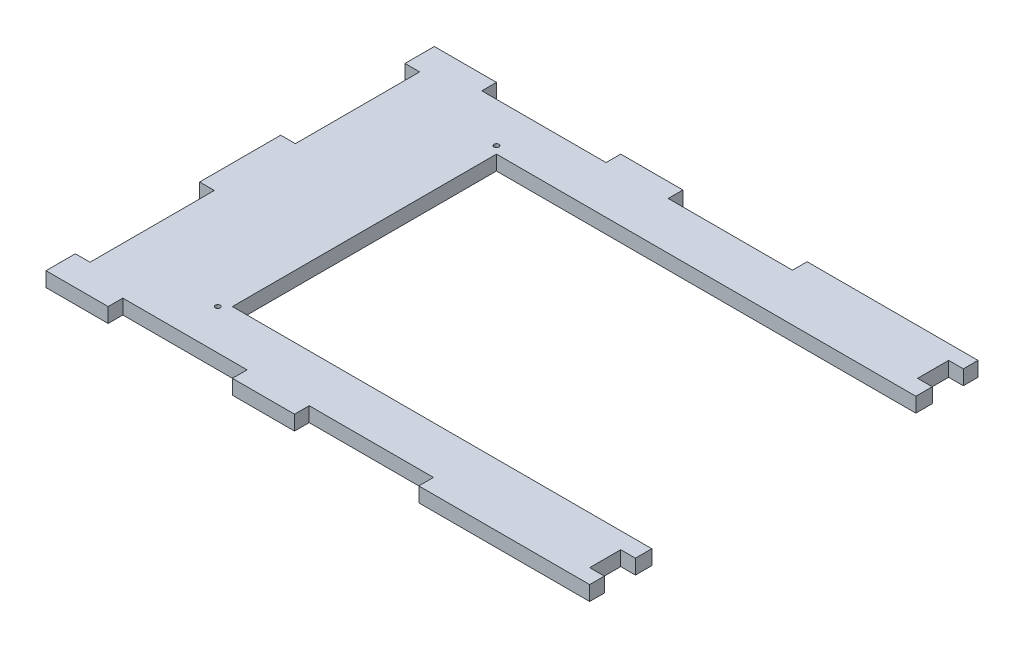
from build123d import *

# Parameters (mm, degrees)
SKETCH1_R           = 0.5
BOSS_EXTRUDE1_DEPTH = 3


with BuildPart() as part:
    # Sketch1 → Boss-Extrude1 (new body)
    with BuildSketch(Plane(origin=(0, 0, 0), x_dir=(1, 0, 0), z_dir=(0, 1, 0))):
        Polygon((42.8625, 26.9875), (42.8625, 30.3375), (39.8625, 30.3375), (39.8625, 36.6875), (42.8625, 36.6875), (42.8625, 39.6875), (7.9375, 39.6875), (7.9375, 36.6875), (-17.4625, 36.6875), (-17.4625, 39.6875), (-30.1625, 39.6875), (-30.1625, 36.6875), (-55.5625, 36.6875), (-55.5625, 39.6875), (-68.2625, 39.6875), (-68.2625, 33.6875), (-65.2625, 33.6875), (-65.2625, 8.2875), (-68.2625, 8.2875), (-68.2625, -8.2875), (-65.2625, -8.2875), (-65.2625, -33.6875), (-68.2625, -33.6875), (-68.2625, -39.6875), (-55.5625, -39.6875), (-55.5625, -36.6875), (-30.1625, -36.6875), (-30.1625, -39.6875), (-17.4625, -39.6875), (-17.4625, -36.6875), (7.9375, -36.6875), (7.9375, -39.6875), (42.8625, -39.6875), (42.8625, -36.6875), (39.8625, -36.6875), (39.8625, -30.3375), (42.8625, -30.3375), (42.8625, -26.9875), (-42.8625, -26.9875), (-42.8625, 26.9875), align=None)
        with Locations(Location((-44.361566376, 28.486566376, 0), (0, 0, 270))):
            Circle(SKETCH1_R, mode=Mode.SUBTRACT)
        with Locations(Location((-44.361566376, -28.486566376, 0), (0, 0, 270))):
            Circle(SKETCH1_R, mode=Mode.SUBTRACT)
    extrude(amount=BOSS_EXTRUDE1_DEPTH)


solid = part.part
